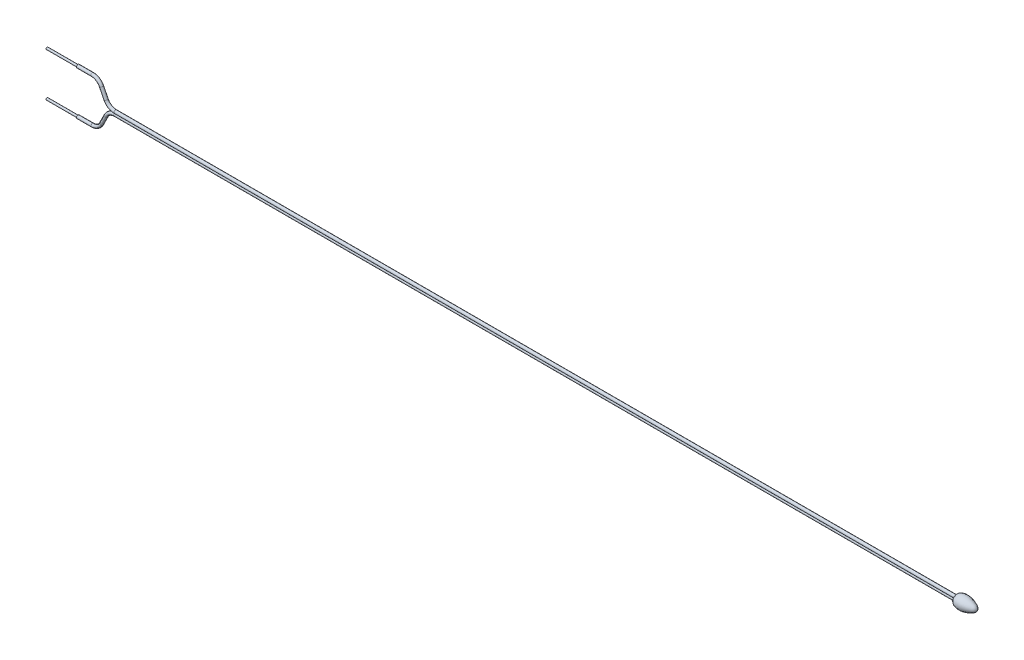
from build123d import *

# Parameters (mm, degrees)
SKETCH_3_R          = 0.15
SKETCH_4_R          = 0.223077301
SKETCH_4_R_2        = 0.1
CUT_EXTRUDE_1_DEPTH = 3


with BuildPart() as part:
    # Эскиз1 → Повернуть1 (revolve)
    with BuildSketch(Plane.XY):
        with BuildLine():
            Line((0, 0), (0, 0.3))
            add(Edge.make_bspline(
                [(0, 0.3), (0.11509679, 0.551800246), (0.767947767, 0.661200883), (1.447067915, 0.470950787), (1.985552848, 0.226242678), (2, 0)],
                knots=[0, 0, 0, 0, 0.344144109, 0.722890882, 1, 1, 1, 1], degree=3))
            Line((2, 0), (0, 0))
        make_face()
    revolve(axis=Axis((0, 0, 0), (1, 0, 0)))

    # По траектории1: sweep along a path in Эскиз2
    with BuildLine(Plane.XY) as sweep_1_path:
        Line((0, 0.12), (-81.381966011, 0.12))
        ThreePointArc((-81.381966011, 0.12), (-81.907697123, 0.269349192), (-82.276393202, 0.672786405))
        Line((-82.276393202, 0.672786405), (-82.723606798, 1.567213595))
        ThreePointArc((-82.723606798, 1.567213595), (-83.092302877, 1.970650808), (-83.618033989, 2.12))
        Line((-83.618033989, 2.12), (-88, 2.12))
    # Эскиз3 → По траектории1 (sweep)
    with BuildSketch(Plane.ZY):
        with Locations((0, 0.12)):
            Circle(SKETCH_3_R)
    sweep_1 = sweep(path=sweep_1_path.line)

    # Эскиз4 → Вырез-Вытянуть1 (cut)
    with BuildSketch(Plane.ZY.offset(88)):
        with Locations((0, 2.12)):
            Circle(SKETCH_4_R)
        with Locations((0, 2.12)):
            Circle(SKETCH_4_R_2, mode=Mode.SUBTRACT)
    cut_extrude_1 = extrude(amount=-CUT_EXTRUDE_1_DEPTH, mode=Mode.SUBTRACT)

    # Зеркальное отражение3: По траектории1, Вырез-Вытянуть1 across plane
    add(sweep_1.mirror(Plane.ZX))
    add(cut_extrude_1.mirror(Plane.ZX), mode=Mode.SUBTRACT)


solid = part.part
